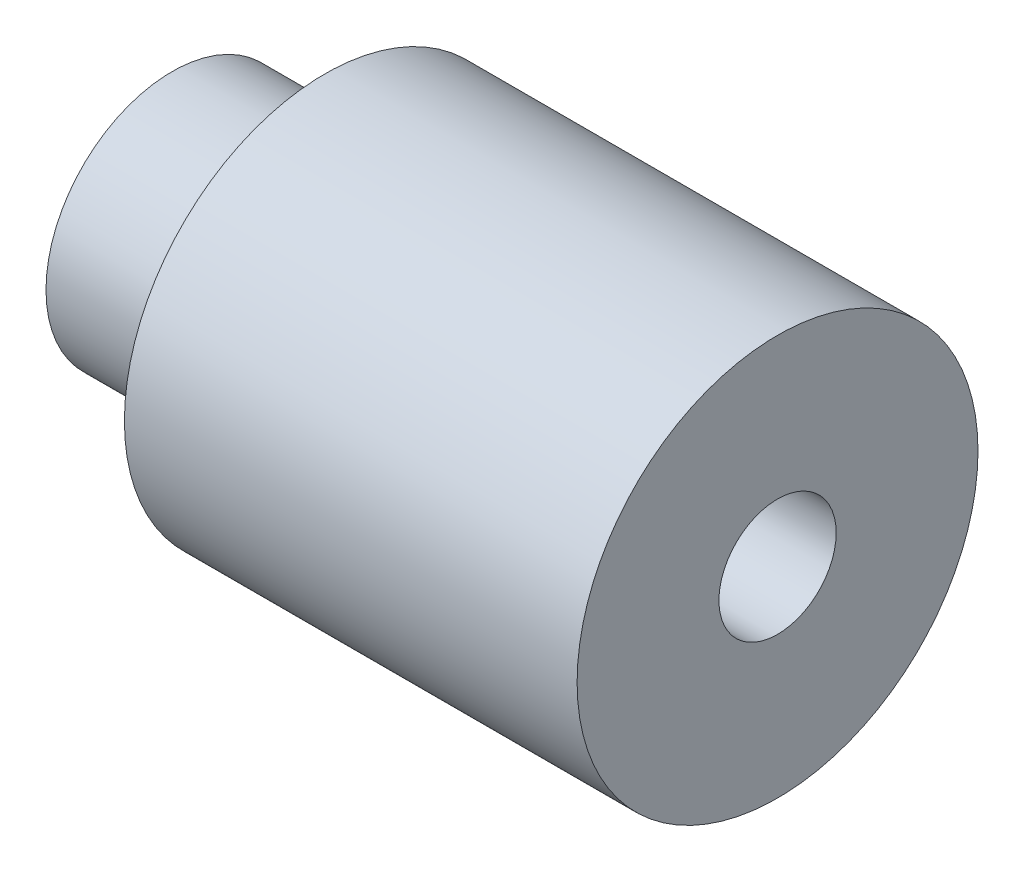
from build123d import *

# Parameters (mm, degrees)
SKETCH1_R           = 4.625
SKETCH1_R_2         = 2.15
BOSS_EXTRUDE1_DEPTH = 5.6
SKETCH2_R           = 7.35
SKETCH2_R_2         = 2.15
BOSS_EXTRUDE2_DEPTH = 16.6


with BuildPart() as part:
    # Sketch1 → Boss-Extrude1 (new body)
    with BuildSketch(Plane(origin=(0, 0, 0), x_dir=(0, 0, -1), z_dir=(1, 0, 0))):
        Circle(SKETCH1_R)
        Circle(SKETCH1_R_2, mode=Mode.SUBTRACT)
    extrude(amount=BOSS_EXTRUDE1_DEPTH)

    # Sketch2 → Boss-Extrude2 (add)
    with BuildSketch(Plane(origin=(5.6, 0, 0), x_dir=(0, 0, -1), z_dir=(1, 0, 0))):
        with Locations(Location((0, 0, 0), (0, 0, 180))):
            Circle(SKETCH2_R)
        Circle(SKETCH2_R_2, mode=Mode.SUBTRACT)
    extrude(amount=BOSS_EXTRUDE2_DEPTH)


solid = part.part
